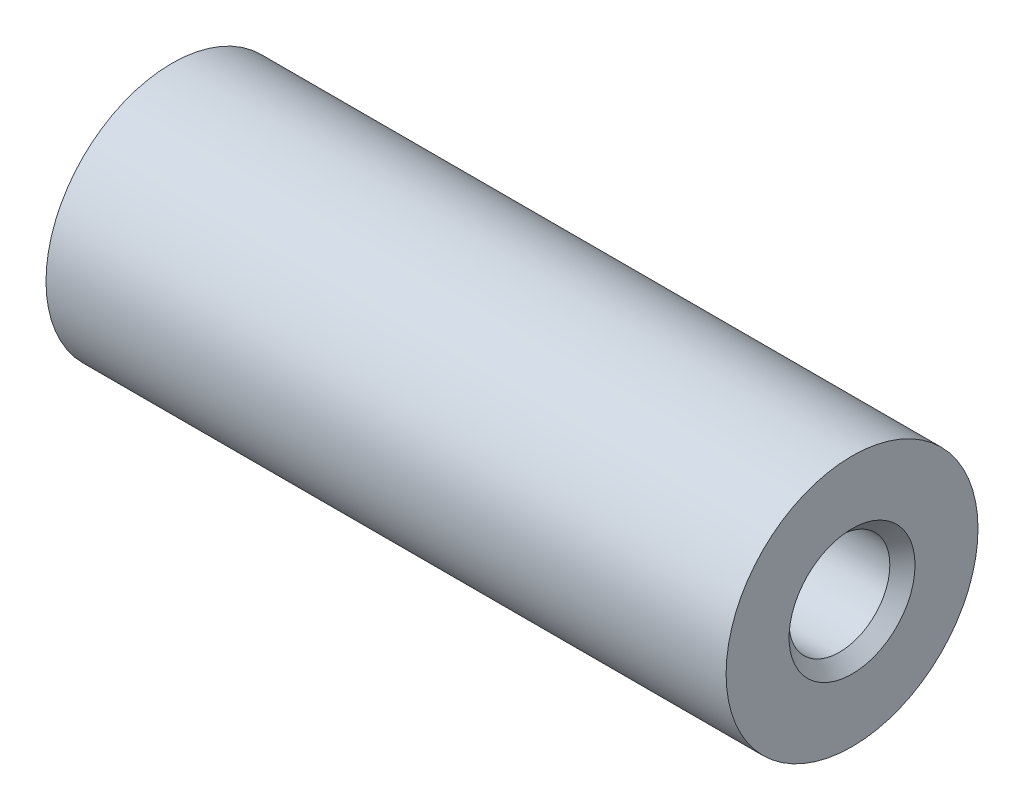
from build123d import *

# Parameters (mm, degrees)
SKIZZE1_R                        = 4
AUFSATZ_LINEAR_AUSTRAGEN1_DEPTH  = 21.6
F_3_2_3_2_DURCHMESSER_BOHRUNG1_D = 3.2
FASE1_SIZE                       = 0.4


with BuildPart() as part:
    # Skizze1 → Aufsatz-Linear austragen1 (new body)
    with BuildSketch(Plane(origin=(0, 0, 0), x_dir=(0, 0, -1), z_dir=(1, 0, 0))):
        with Locations(Location((0, 0, 0), (0, 0, 180))):
            Circle(SKIZZE1_R)
    extrude(amount=AUFSATZ_LINEAR_AUSTRAGEN1_DEPTH)

    # Ø3.2 (3.2) Durchmesser Bohrung1 (through all)
    with Locations(Plane(origin=(21.6, 0, 0), x_dir=(0, 0, -1), z_dir=(1, 0, 0))):
        with Locations((0, 0)):
            Hole(F_3_2_3_2_DURCHMESSER_BOHRUNG1_D / 2)

    # Fase1
    fase1_edges = [part.edges().sort_by_distance(p)[0] for p in [
        (21.6, 0, -1.6),
        (0, 0, -1.6),
    ]]
    chamfer(fase1_edges, length=FASE1_SIZE)


solid = part.part
